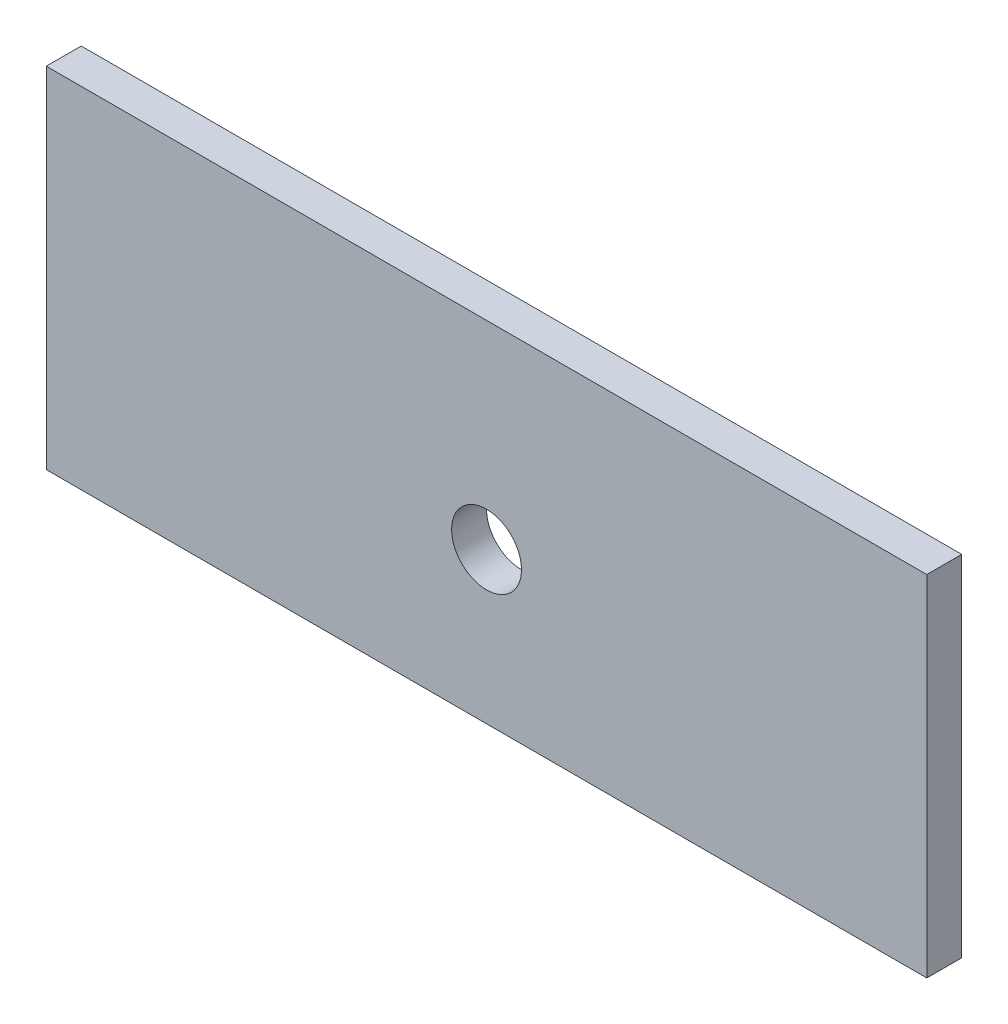
from build123d import *

# Parameters (mm, degrees)
SKETCH4_W           = 80.01
SKETCH4_H           = 31.75
BOSS_EXTRUDE1_DEPTH = 3.175
SKETCH5_R           = 3.175
CUT_EXTRUDE1_DEPTH  = 12.7


with BuildPart() as part:
    # Sketch4 → Boss-Extrude1 (new body)
    with BuildSketch(Plane.XY):
        with Locations((27.072735574, 6.116991948)):
            Rectangle(SKETCH4_W, SKETCH4_H)
    extrude(amount=BOSS_EXTRUDE1_DEPTH)

    # Sketch5 → Cut-Extrude1 (cut)
    with BuildSketch(Plane(origin=(0, 0, 0), x_dir=(-1, 0, 0), z_dir=(0, 0, -1))):
        with Locations((-27.072735574, 3.957991948)):
            Circle(SKETCH5_R)
    extrude(amount=-CUT_EXTRUDE1_DEPTH, mode=Mode.SUBTRACT)


solid = part.part
